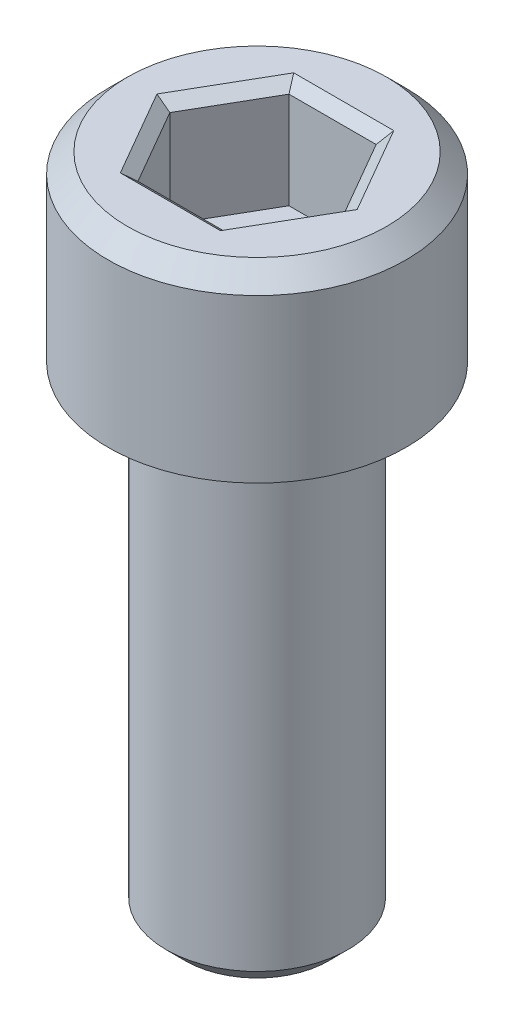
from build123d import *

# Parameters (mm, degrees)
EXTRUDE1_DEPTH = 2.794
CHAMFER1_SIZE  = 0.508
CHAMFER2_SIZE  = 0.29329394
CHAMFER2_SIZE2 = 0.253999961


with BuildPart() as part:
    # Sketch1 → Revolve1 (revolve)
    with BuildSketch(Plane.XY, mode=Mode.PRIVATE) as revolve1_sk:
        Polygon((0, 0), (0, 17.4752), (-3.9116, 17.4752), (-3.9116, 12.7), (-2.3876, 12.7), (-2.3876, 0), align=None)
    revolve(revolve1_sk.sketch.rotate(Axis((0, 0, 0), (0, 1, 0)), 270), axis=Axis((0, 0, 0), (0, 1, 0)))

    # Sketch2 → Extrude1 (cut)
    with BuildSketch(Plane(origin=(0, 17.4752, 0), x_dir=(1, 0, 0), z_dir=(0, 1, 0))):
        Polygon((2.2913594, 0), (1.1456797, 1.98437545), (-1.1456797, 1.98437545), (-2.2913594, 0), (-1.1456797, -1.98437545), (1.1456797, -1.98437545), align=None)
    extrude(amount=-EXTRUDE1_DEPTH, mode=Mode.SUBTRACT)

    # Chamfer1
    chamfer1_edges = [part.edges().sort_by_distance(p)[0] for p in [
        (0, 0, 2.3876),
        (0, 17.4752, 3.9116),
    ]]
    chamfer(chamfer1_edges, length=CHAMFER1_SIZE)

    # Chamfer2
    chamfer2_edges = [part.edges().sort_by_distance(p)[0] for p in [
        (1.71851955, 17.4752, 0.992187725),
        (1.71851955, 17.4752, -0.992187725),
        (0, 17.4752, -1.98437545),
        (-1.71851955, 17.4752, -0.992187725),
        (-1.71851955, 17.4752, 0.992187725),
        (0, 17.4752, 1.98437545),
    ]]
    chamfer2_side = [part.faces().sort_by_distance(p)[0] for p in [
        (0, 17.4752, 3.307331654),
    ]]
    chamfer(chamfer2_edges, length=CHAMFER2_SIZE, length2=CHAMFER2_SIZE2, reference=chamfer2_side[0])


solid = part.part
